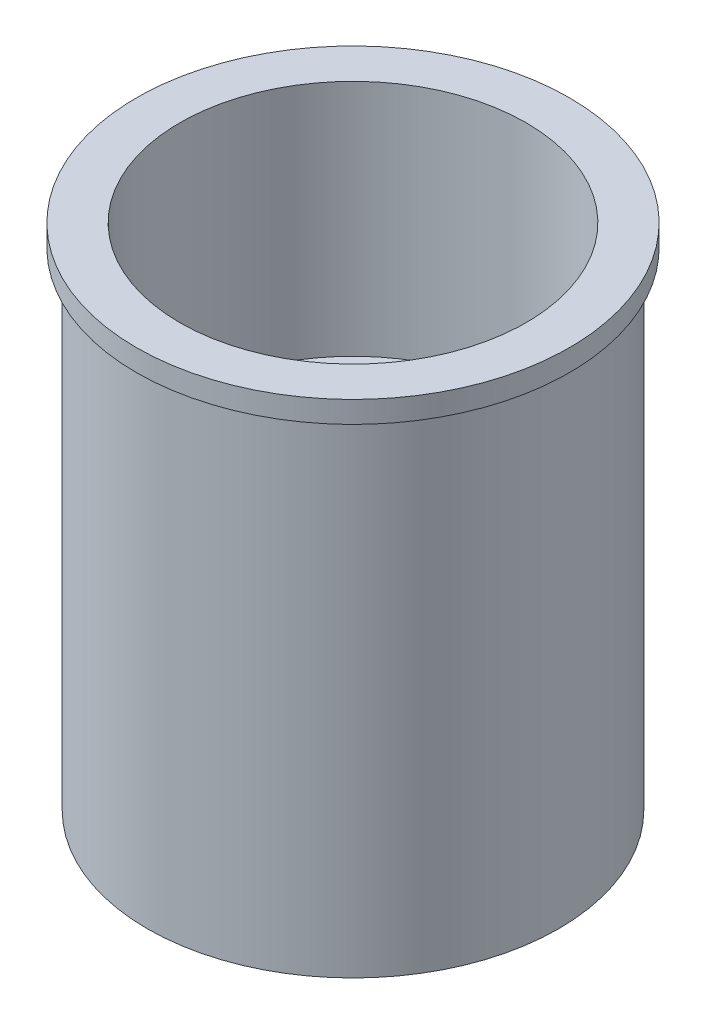
from build123d import *


with BuildPart() as part:
    # Esquisse1 → Révolution1 (revolve)
    with BuildSketch(Plane.XY, mode=Mode.PRIVATE) as r_volution1_sk:
        Polygon((-16, -15.162162162), (-16, 6.837837838), (-14, 6.837837838), (-14, 9.837837838), (-16, 9.837837838), (-16, 31.837837838), (-20, 31.837837838), (-20, 29.837837838), (-19, 29.837837838), (-19, -15.162162162), align=None)
    revolve(r_volution1_sk.sketch.rotate(Axis((0, 35.189189189, 0), (0, -1, 0)), 270), axis=Axis((0, 35.189189189, 0), (0, -1, 0)))


solid = part.part
